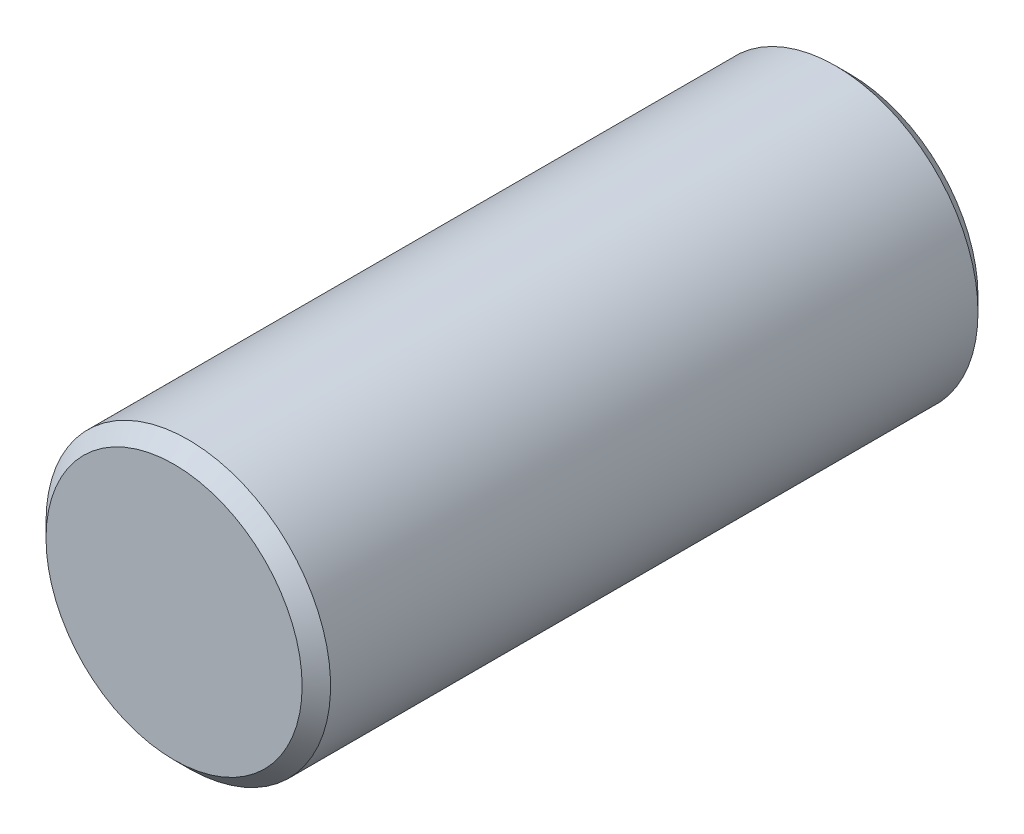
from build123d import *

# Parameters (mm, degrees)
SKETCH1_R           = 12.7
BOSS_EXTRUDE1_DEPTH = 60.325
CHAMFER1_SIZE       = 1.27


with BuildPart() as part:
    # Sketch1 → Boss-Extrude1 (new body)
    with BuildSketch(Plane.XY):
        with Locations(Location((0, 0, 0), (0, 0, 180))):
            Circle(SKETCH1_R)
    extrude(amount=BOSS_EXTRUDE1_DEPTH)

    # Chamfer1
    chamfer1_edges = [part.edges().sort_by_distance(p)[0] for p in [
        (12.7, 0, 0),
        (12.7, 0, 60.325),
    ]]
    chamfer(chamfer1_edges, length=CHAMFER1_SIZE)


solid = part.part
